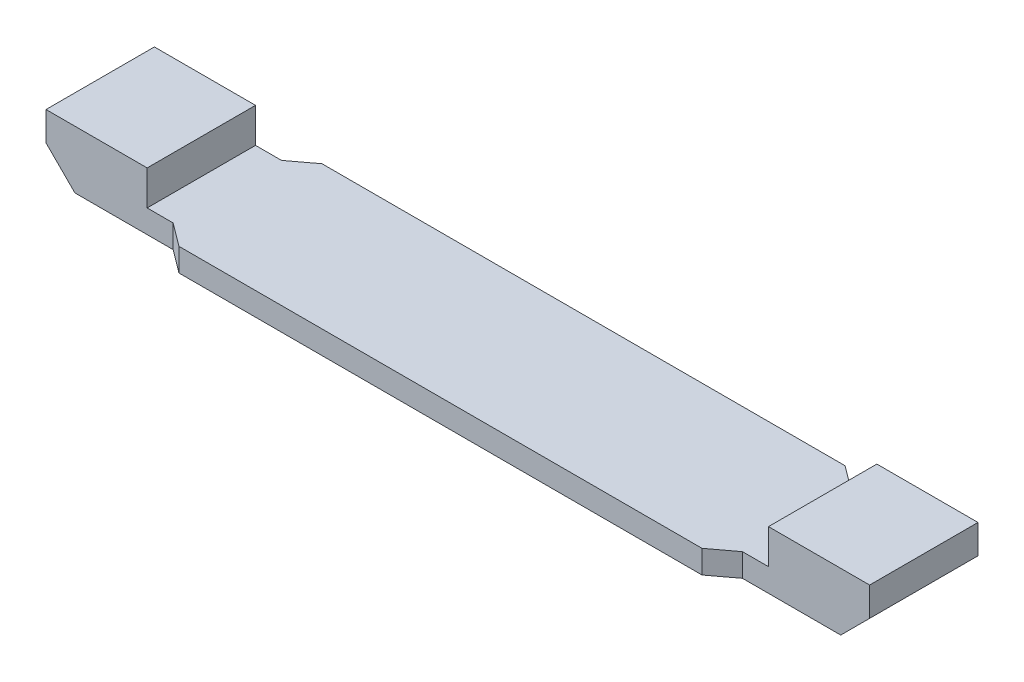
from build123d import *

# Parameters (mm, degrees)
SKETCH1_W           = 285
SKETCH1_H           = 71.5
BOSS_EXTRUDE1_DEPTH = 8
SKETCH2_W           = 35
SKETCH2_H           = 71.5
BOSS_EXTRUDE2_DEPTH = 12
CUT_EXTRUDE2_DEPTH  = 295.51188431
CHAMFER1_SIZE       = 10


with BuildPart() as part:
    # Sketch1 → Boss-Extrude1 (new body)
    with BuildSketch(Plane(origin=(0, 0, 0), x_dir=(1, 0, 0), z_dir=(0, 1, 0))):
        with Locations((142.5, 35.75)):
            Rectangle(SKETCH1_W, SKETCH1_H)
    extrude(amount=BOSS_EXTRUDE1_DEPTH)

    # Sketch2 → Boss-Extrude2 (add)
    with BuildSketch(Plane(origin=(0, 8, 0), x_dir=(1, 0, 0), z_dir=(0, 1, 0))):
        with Locations((17.5, 35.75)):
            Rectangle(SKETCH2_W, SKETCH2_H)
        with Locations((267.5, 35.75)):
            Rectangle(SKETCH2_W, SKETCH2_H)
    extrude(amount=BOSS_EXTRUDE2_DEPTH)

    # Sketch4 → Cut-Extrude2 (cut, through all)
    with BuildSketch(Plane.XZ):
        Polygon((0, -17), (44, -17), (52, -11), (233, -11), (241, -17), (285, -17), (285, 0), (0, 0), align=None)
        Polygon((44, -54.5), (52, -60.5), (233, -60.5), (241, -54.5), (285, -54.5), (285, -71.5), (0, -71.5), (0, -54.5), align=None)
    extrude(amount=-CUT_EXTRUDE2_DEPTH, mode=Mode.SUBTRACT)

    # Chamfer1
    chamfer1_edges = [part.edges().sort_by_distance(p)[0] for p in [
        (0, 0, -35.75),
        (285, 0, -35.75),
    ]]
    chamfer(chamfer1_edges, length=CHAMFER1_SIZE)


solid = part.part
